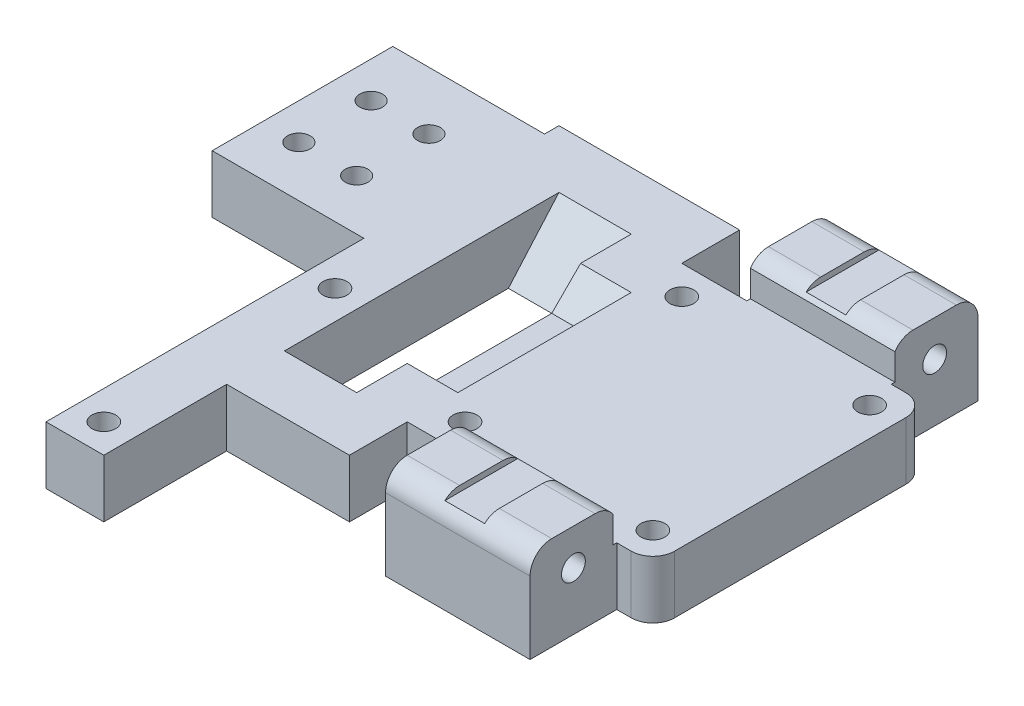
from build123d import *

# Parameters (mm, degrees)
SKETCH1_W            = 300
SKETCH1_H            = 20
BOSS_EXTRUDE1_DEPTH  = 8
SKETCH2_W            = 34
SKETCH2_H            = 8
BOSS_EXTRUDE2_DEPTH  = 9
SKETCH3_W            = 34
SKETCH3_H            = 8
BOSS_EXTRUDE3_DEPTH  = 9
SKETCH4_R            = 1.65
CUT_EXTRUDE1_DEPTH   = 302.504560496
SKETCH5_W            = 25
SKETCH5_H            = 8
BOSS_EXTRUDE4_DEPTH  = 17
SKETCH6_W            = 25
SKETCH6_H            = 8
BOSS_EXTRUDE5_DEPTH  = 17
SKETCH7_W            = 10
SKETCH7_H            = 38
CUT_EXTRUDE2_DEPTH   = 303.37890138
SKETCH8_W            = 7
SKETCH8_H            = 16
CUT_EXTRUDE3_DEPTH   = 4
CUT_EXTRUDE4_DEPTH   = 7
BOSS_EXTRUDE6_DEPTH  = 10
SKETCH12_W           = 8
SKETCH12_H           = 8
BOSS_EXTRUDE7_DEPTH  = 17
SKETCH13_R           = 1.65
CUT_EXTRUDE6_DEPTH   = 305.926220585
SKETCH14_W           = 20
SKETCH14_H           = 13
BOSS_EXTRUDE8_DEPTH  = 12
SKETCH15_R           = 1.65
CUT_EXTRUDE7_DEPTH   = 20
SKETCH16_W           = 20
SKETCH16_H           = 13
BOSS_EXTRUDE9_DEPTH  = 12
SKETCH17_R           = 1.65
CUT_EXTRUDE8_DEPTH   = 20
SKETCH18_W           = 20
SKETCH18_H           = 13
BOSS_EXTRUDE10_DEPTH = 12
SKETCH19_R           = 1.6
CUT_EXTRUDE9_DEPTH   = 20
SKETCH20_W           = 20
SKETCH20_H           = 13
BOSS_EXTRUDE11_DEPTH = 12
SKETCH21_R           = 1.6
CUT_EXTRUDE10_DEPTH  = 20
FILLET6_R            = 3
SKETCH28_W           = 198.881436238
SKETCH28_H           = 556.355103816
CUT_EXTRUDE14_DEPTH  = 220
SKETCH29_W           = 21
SKETCH29_H           = 8
BOSS_EXTRUDE12_DEPTH = 15
SKETCH30_W           = 21
SKETCH30_H           = 10
CUT_EXTRUDE15_DEPTH  = 306.0983448
SKETCH31_R           = 1.575
CUT_EXTRUDE16_DEPTH  = 306.0983448
FILLET7_R            = 3
SKETCH32_W           = 5.5
SKETCH32_H           = 70.463459777
CUT_EXTRUDE17_DEPTH  = 0.8
SKETCH33_W           = 20
SKETCH33_H           = 4.963841857
CUT_EXTRUDE18_DEPTH  = 0.5
SKETCH34_W           = 20
SKETCH34_H           = 11.942443484
CUT_EXTRUDE19_DEPTH  = 0.5


with BuildPart() as part:
    # Sketch1 → Boss-Extrude1 (new body)
    with BuildSketch(Plane(origin=(0, 0, 0), x_dir=(1, 0, 0), z_dir=(0, 1, 0))):
        with Locations((150, -10)):
            Rectangle(SKETCH1_W, SKETCH1_H)
    extrude(amount=BOSS_EXTRUDE1_DEPTH)

    # Sketch2 → Boss-Extrude2 (add)
    with BuildSketch(Plane.XY.offset(20)):
        with Locations((17, 4)):
            Rectangle(SKETCH2_W, SKETCH2_H)
        with Locations((283, 4)):
            Rectangle(SKETCH2_W, SKETCH2_H)
    extrude(amount=BOSS_EXTRUDE2_DEPTH)

    # Sketch3 → Boss-Extrude3 (add)
    with BuildSketch(Plane(origin=(0, 0, 0), x_dir=(-1, 0, 0), z_dir=(0, 0, -1))):
        with Locations((-17, 4)):
            Rectangle(SKETCH3_W, SKETCH3_H)
        with Locations((-283, 4)):
            Rectangle(SKETCH3_W, SKETCH3_H)
    extrude(amount=BOSS_EXTRUDE3_DEPTH)

    # Sketch4 → Cut-Extrude1 (cut, through all)
    with BuildSketch(Plane(origin=(0, 8, 0), x_dir=(1, 0, 0), z_dir=(0, 1, 0))):
        with Locations(Location((4, 5, 0), (0, 0, 270))):
            Circle(SKETCH4_R)
        with Locations(Location((30, 5, 0), (0, 0, 270))):
            Circle(SKETCH4_R)
        with Locations(Location((30, -25, 0), (0, 0, 270))):
            Circle(SKETCH4_R)
        with Locations(Location((4, -25, 0), (0, 0, 270))):
            Circle(SKETCH4_R)
        with Locations(Location((296, -25, 0), (0, 0, 270))):
            Circle(SKETCH4_R)
        with Locations(Location((296, 5, 0), (0, 0, 270))):
            Circle(SKETCH4_R)
        with Locations(Location((270, -25, 0), (0, 0, 270))):
            Circle(SKETCH4_R)
        with Locations(Location((270, 5, 0), (0, 0, 270))):
            Circle(SKETCH4_R)
    extrude(amount=-CUT_EXTRUDE1_DEPTH, mode=Mode.SUBTRACT)

    # Sketch5 → Boss-Extrude4 (add)
    with BuildSketch(Plane.XY.offset(20)):
        with Locations((253.5, 4)):
            Rectangle(SKETCH5_W, SKETCH5_H)
    extrude(amount=BOSS_EXTRUDE4_DEPTH)

    # Sketch6 → Boss-Extrude5 (add)
    with BuildSketch(Plane(origin=(0, 0, 0), x_dir=(-1, 0, 0), z_dir=(0, 0, -1))):
        with Locations((-253.5, 4)):
            Rectangle(SKETCH6_W, SKETCH6_H)
    extrude(amount=BOSS_EXTRUDE5_DEPTH)

    # Sketch7 → Cut-Extrude2 (cut, through all)
    with BuildSketch(Plane(origin=(0, 8, 0), x_dir=(1, 0, 0), z_dir=(0, 1, 0))):
        with Locations((254, -10)):
            Rectangle(SKETCH7_W, SKETCH7_H)
    extrude(amount=-CUT_EXTRUDE2_DEPTH, mode=Mode.SUBTRACT)

    # Sketch8 → Cut-Extrude3 (cut)
    with BuildSketch(Plane(origin=(0, 8, 0), x_dir=(1, 0, 0), z_dir=(0, 1, 0))):
        with Locations((262.5, -10)):
            Rectangle(SKETCH8_W, SKETCH8_H)
    extrude(amount=-CUT_EXTRUDE3_DEPTH, mode=Mode.SUBTRACT)

    # Sketch9 → Cut-Extrude4 (cut)
    with BuildSketch(Plane.ZY.offset(-259)):
        Polygon((18, 4), (22, 8), (18, 8), align=None)
        Polygon((2, 4), (-2, 8), (2, 8), align=None)
    extrude(amount=-CUT_EXTRUDE4_DEPTH, mode=Mode.SUBTRACT)

    # Sketch10 → Boss-Extrude6 (add)
    with BuildSketch(Plane.ZY.offset(-259)):
        Polygon((-2, 0), (-9, 8), (-9, 0), align=None)
        Polygon((29, 8), (22, 0), (29, 0), align=None)
    extrude(amount=BOSS_EXTRUDE6_DEPTH)

    # Sketch12 → Boss-Extrude7 (add)
    with BuildSketch(Plane.XY.offset(37)):
        with Locations((245, 4)):
            Rectangle(SKETCH12_W, SKETCH12_H)
    extrude(amount=BOSS_EXTRUDE7_DEPTH)

    # Sketch13 → Cut-Extrude6 (cut, through all)
    with BuildSketch(Plane(origin=(0, 8, 0), x_dir=(1, 0, 0), z_dir=(0, 1, 0))):
        with Locations(Location((245, -50, 0), (0, 0, 270))):
            Circle(SKETCH13_R)
        with Locations(Location((245, -18, 0), (0, 0, 270))):
            Circle(SKETCH13_R)
    extrude(amount=-CUT_EXTRUDE6_DEPTH, mode=Mode.SUBTRACT)

    # Sketch14 → Boss-Extrude8 (add)
    with BuildSketch(Plane.XY.offset(29)):
        with Locations((285, 6.5)):
            Rectangle(SKETCH14_W, SKETCH14_H)
    extrude(amount=BOSS_EXTRUDE8_DEPTH)

    # Sketch15 → Cut-Extrude7 (cut)
    with BuildSketch(Plane(origin=(295, 0, 0), x_dir=(0, 0, -1), z_dir=(1, 0, 0))):
        with Locations((-35, 8)):
            Circle(SKETCH15_R)
    extrude(amount=-CUT_EXTRUDE7_DEPTH, mode=Mode.SUBTRACT)

    # Sketch16 → Boss-Extrude9 (add)
    with BuildSketch(Plane(origin=(0, 0, -9), x_dir=(-1, 0, 0), z_dir=(0, 0, -1))):
        with Locations((-285, 6.5)):
            Rectangle(SKETCH16_W, SKETCH16_H)
    extrude(amount=BOSS_EXTRUDE9_DEPTH)

    # Sketch17 → Cut-Extrude8 (cut)
    with BuildSketch(Plane(origin=(295, 0, 0), x_dir=(0, 0, -1), z_dir=(1, 0, 0))):
        with Locations((15, 8)):
            Circle(SKETCH17_R)
    extrude(amount=-CUT_EXTRUDE8_DEPTH, mode=Mode.SUBTRACT)

    # Sketch18 → Boss-Extrude10 (add)
    with BuildSketch(Plane(origin=(0, 0, -9), x_dir=(-1, 0, 0), z_dir=(0, 0, -1))):
        with Locations((-15, 6.5)):
            Rectangle(SKETCH18_W, SKETCH18_H)
    extrude(amount=BOSS_EXTRUDE10_DEPTH)

    # Sketch19 → Cut-Extrude9 (cut)
    with BuildSketch(Plane.ZY.offset(-5)):
        with Locations((-15, 8)):
            Circle(SKETCH19_R)
    extrude(amount=-CUT_EXTRUDE9_DEPTH, mode=Mode.SUBTRACT)

    # Sketch20 → Boss-Extrude11 (add)
    with BuildSketch(Plane.XY.offset(29)):
        with Locations((15, 6.5)):
            Rectangle(SKETCH20_W, SKETCH20_H)
    extrude(amount=BOSS_EXTRUDE11_DEPTH)

    # Sketch21 → Cut-Extrude10 (cut)
    with BuildSketch(Plane.ZY.offset(-5)):
        with Locations((35, 8)):
            Circle(SKETCH21_R)
    extrude(amount=-CUT_EXTRUDE10_DEPTH, mode=Mode.SUBTRACT)

    # Fillet6
    fillet6_edges = [part.edges().sort_by_distance(p)[0] for p in [
        (285, 13, 29),
        (285, 13, 41),
        (285, 13, -9),
        (285, 13, -21),
        (15, 13, -9),
        (15, 13, -21),
        (15, 13, 29),
        (15, 13, 41),
    ]]
    fillet(fillet6_edges, radius=FILLET6_R)

    # Sketch28 → Cut-Extrude14 (cut)
    with BuildSketch(Plane.ZY):
        with Locations((-20.495432896, -60.484201615)):
            Rectangle(SKETCH28_W, SKETCH28_H)
    extrude(amount=-CUT_EXTRUDE14_DEPTH, mode=Mode.SUBTRACT)

    # Sketch29 → Boss-Extrude12 (add)
    with BuildSketch(Plane(origin=(0, 0, 0), x_dir=(-1, 0, 0), z_dir=(0, 0, -1))):
        with Locations((-230.5, 4)):
            Rectangle(SKETCH29_W, SKETCH29_H)
    extrude(amount=BOSS_EXTRUDE12_DEPTH)

    # Sketch30 → Cut-Extrude15 (cut, through all)
    with BuildSketch(Plane(origin=(0, 0, 0), x_dir=(-1, 0, 0), z_dir=(0, -1, 0))):
        with Locations((-230.5, -15)):
            Rectangle(SKETCH30_W, SKETCH30_H)
    extrude(amount=-CUT_EXTRUDE15_DEPTH, mode=Mode.SUBTRACT)

    # Sketch31 → Cut-Extrude16 (cut, through all)
    with BuildSketch(Plane(origin=(0, 0, 0), x_dir=(-1, 0, 0), z_dir=(0, -1, 0))):
        with Locations(Location((-225, 7, 0), (0, 0, 90))):
            Circle(SKETCH31_R)
        with Locations(Location((-225, -3, 0), (0, 0, 90))):
            Circle(SKETCH31_R)
        with Locations(Location((-233, 7, 0), (0, 0, 90))):
            Circle(SKETCH31_R)
        with Locations(Location((-233, -3, 0), (0, 0, 90))):
            Circle(SKETCH31_R)
    extrude(amount=-CUT_EXTRUDE16_DEPTH, mode=Mode.SUBTRACT)

    # Fillet7
    fillet7_edges = [part.edges().sort_by_distance(p)[0] for p in [
        (300, 4, 29),
        (300, 4, -9),
    ]]
    fillet(fillet7_edges, radius=FILLET7_R)

    # Sketch32 → Cut-Extrude17 (cut)
    with BuildSketch(Plane(origin=(0, 13, 0), x_dir=(1, 0, 0), z_dir=(0, 1, 0))):
        with Locations((285, -7.2213573)):
            Rectangle(SKETCH32_W, SKETCH32_H)
    extrude(amount=-CUT_EXTRUDE17_DEPTH, mode=Mode.SUBTRACT)

    # Sketch33 → Cut-Extrude18 (cut)
    with BuildSketch(Plane(origin=(0, 0, 29), x_dir=(-1, 0, 0), z_dir=(0, 0, -1))):
        with Locations((-285, 10.481920928)):
            Rectangle(SKETCH33_W, SKETCH33_H)
    extrude(amount=-CUT_EXTRUDE18_DEPTH, mode=Mode.SUBTRACT)

    # Sketch34 → Cut-Extrude19 (cut)
    with BuildSketch(Plane.XY.offset(-9)):
        with Locations((285, 13.971221742)):
            Rectangle(SKETCH34_W, SKETCH34_H)
    extrude(amount=-CUT_EXTRUDE19_DEPTH, mode=Mode.SUBTRACT)


solid = part.part
